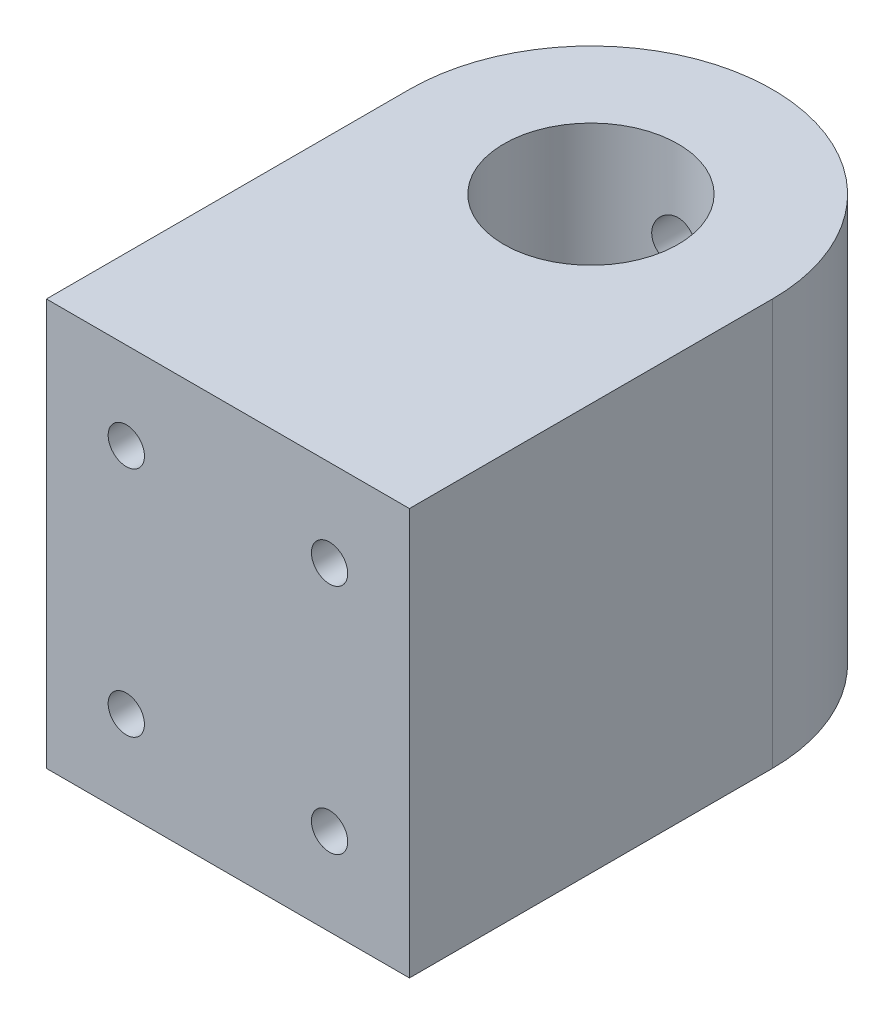
from build123d import *

# Parameters (mm, degrees)
SKETCH_1_R             = 6
EXTRUDE_1_DEPTH        = 14
SKETCH_7_R             = 1.6
CUT_EXTRUDE_2_DEPTH    = 32.260998065
HOLE_WIZARD_M3_1_D     = 2.5
HOLE_WIZARD_M3_1_DEPTH = 9.5
HOLE_WIZARD_M3_1_TIP   = 0.751075774


with BuildPart() as part:
    # 草图1 → 凸台-拉伸1 (new, symmetric)
    with BuildSketch(Plane(origin=(0, 0, 0), x_dir=(1, 0, 0), z_dir=(0, 1, 0))):
        with BuildLine():
            Line((-12.5, -25), (12.5, -25))
            Line((12.5, -25), (12.5, 0))
            ThreePointArc((12.5, 0), (0, 12.5), (-12.5, 0))
            Line((-12.5, 0), (-12.5, -25))
        make_face()
        with Locations(Location((0, 0, 0), (0, 0, 270))):
            Circle(SKETCH_1_R, mode=Mode.SUBTRACT)
    extrude(amount=EXTRUDE_1_DEPTH, both=True)

    # 草图7 → 切除-拉伸2 (cut, through all)
    with BuildSketch(Plane.XY):
        with Locations(Location((0, -8, 0), (0, 0, 90))):
            Circle(SKETCH_7_R)
        with Locations(Location((0, 8, 0), (0, 0, 90))):
            Circle(SKETCH_7_R)
    extrude(amount=-CUT_EXTRUDE_2_DEPTH, mode=Mode.SUBTRACT)

    # M3 螺纹孔1
    with Locations(Plane(origin=(-7, -8, 25), x_dir=(1, 0, 0), z_dir=(0, 0, 1))):
        with Locations((0, 0), (14, 0), (14, 16), (0, 16)):
            Hole(HOLE_WIZARD_M3_1_D / 2, depth=HOLE_WIZARD_M3_1_DEPTH)
            with Locations((0, 0, -(HOLE_WIZARD_M3_1_DEPTH + HOLE_WIZARD_M3_1_TIP / 2))):  # 118° drill point
                Cone(0, HOLE_WIZARD_M3_1_D / 2, HOLE_WIZARD_M3_1_TIP, mode=Mode.SUBTRACT)


solid = part.part
